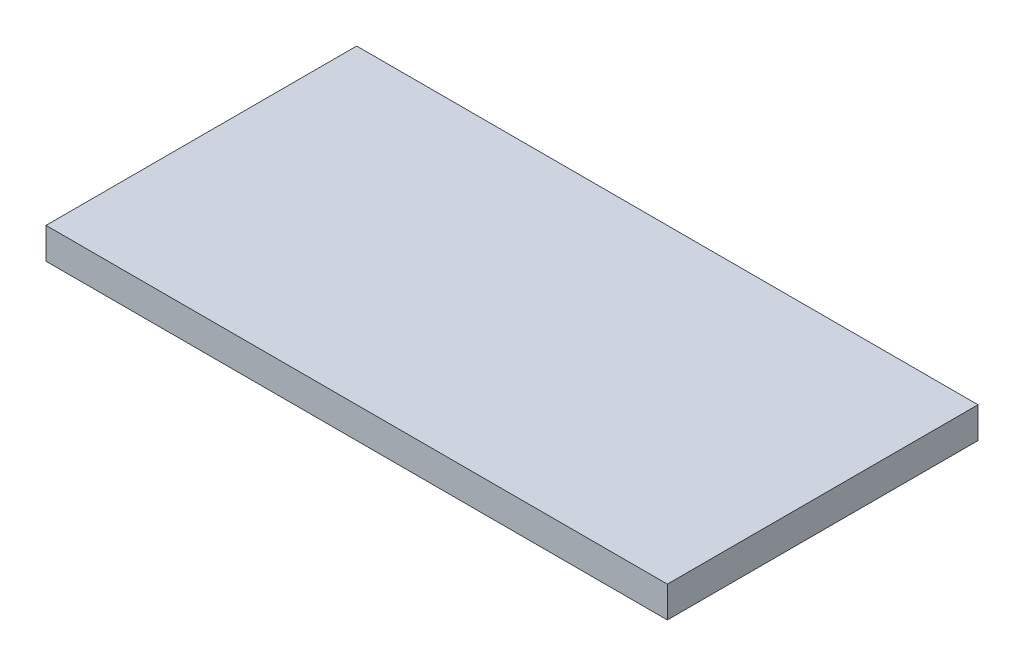
from build123d import *

# Parameters (mm, degrees)
SKETCH2_W           = 127
SKETCH2_H           = 63.5
BOSS_EXTRUDE1_DEPTH = 6.35


with BuildPart() as part:
    # Sketch2 → Boss-Extrude1 (new body)
    with BuildSketch(Plane(origin=(0, 0, 0), x_dir=(1, 0, 0), z_dir=(0, 1, 0))):
        Rectangle(SKETCH2_W, SKETCH2_H)
    extrude(amount=BOSS_EXTRUDE1_DEPTH)


solid = part.part
